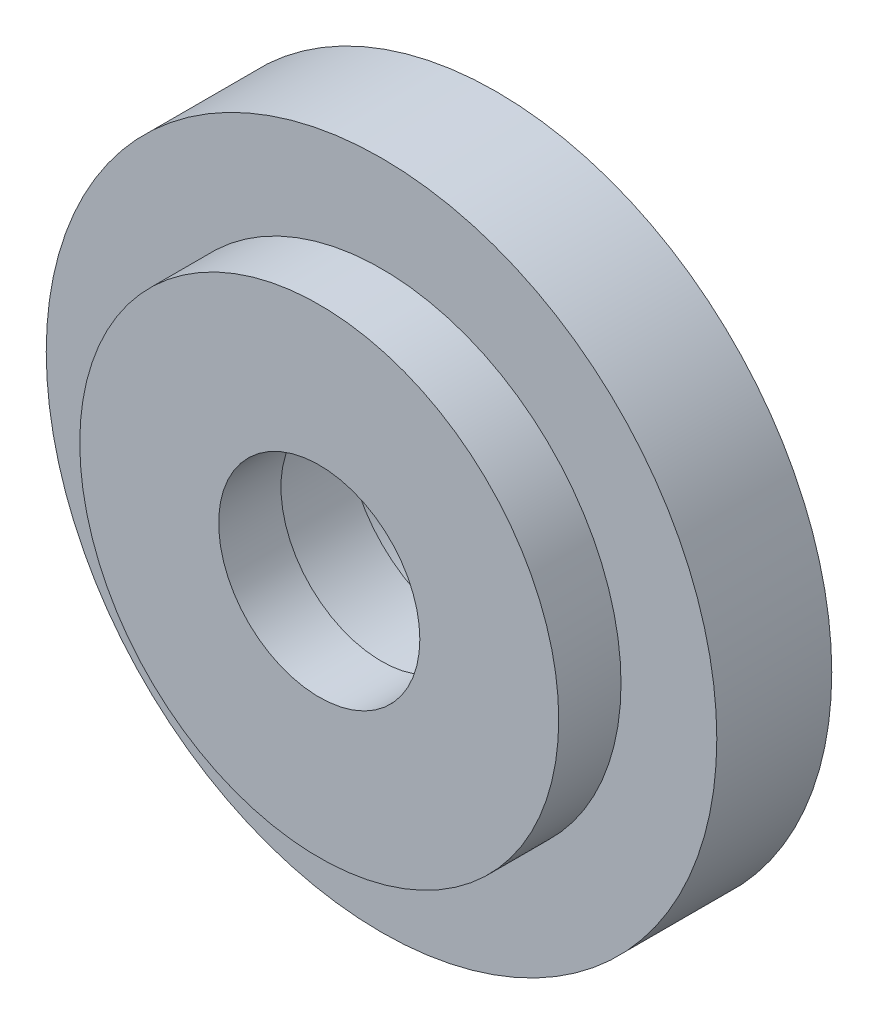
from build123d import *

# Parameters (mm, degrees)
SKETCH1_R           = 12.7
BOSS_EXTRUDE1_DEPTH = 12.7
SKETCH2_R           = 17.78
BOSS_EXTRUDE2_DEPTH = 3.048
SKETCH5_R           = 6.4135
CUT_EXTRUDE1_DEPTH  = 9.398
SKETCH6_R           = 5.334
CUT_EXTRUDE2_DEPTH  = 29.169962726
SKETCH7_R           = 8.255
CUT_EXTRUDE3_DEPTH  = 4.826


with BuildPart() as part:
    # Sketch1 → Boss-Extrude1 (new body)
    with BuildSketch(Plane.XY):
        Circle(SKETCH1_R)
    extrude(amount=BOSS_EXTRUDE1_DEPTH)

    # Sketch2 → Boss-Extrude2 (add, symmetric)
    with BuildSketch(Plane.XY.offset(6.35)):
        with Locations(Location((0, 0, 0), (0, 0, 180))):
            Circle(SKETCH2_R)
    extrude(amount=BOSS_EXTRUDE2_DEPTH, both=True)

    # Sketch5 → Cut-Extrude1 (cut)
    with BuildSketch(Plane(origin=(0, 0, 0), x_dir=(-1, 0, 0), z_dir=(0, 0, -1))):
        Circle(SKETCH5_R)
    extrude(amount=-CUT_EXTRUDE1_DEPTH, mode=Mode.SUBTRACT)

    # Sketch6 → Cut-Extrude2 (cut, through all)
    with BuildSketch(Plane.XY.offset(12.7)):
        Circle(SKETCH6_R)
    extrude(amount=-CUT_EXTRUDE2_DEPTH, mode=Mode.SUBTRACT)

    # Sketch7 → Cut-Extrude3 (cut)
    with BuildSketch(Plane(origin=(0, 0, 0), x_dir=(-1, 0, 0), z_dir=(0, 0, -1))):
        Circle(SKETCH7_R)
    extrude(amount=-CUT_EXTRUDE3_DEPTH, mode=Mode.SUBTRACT)


solid = part.part
